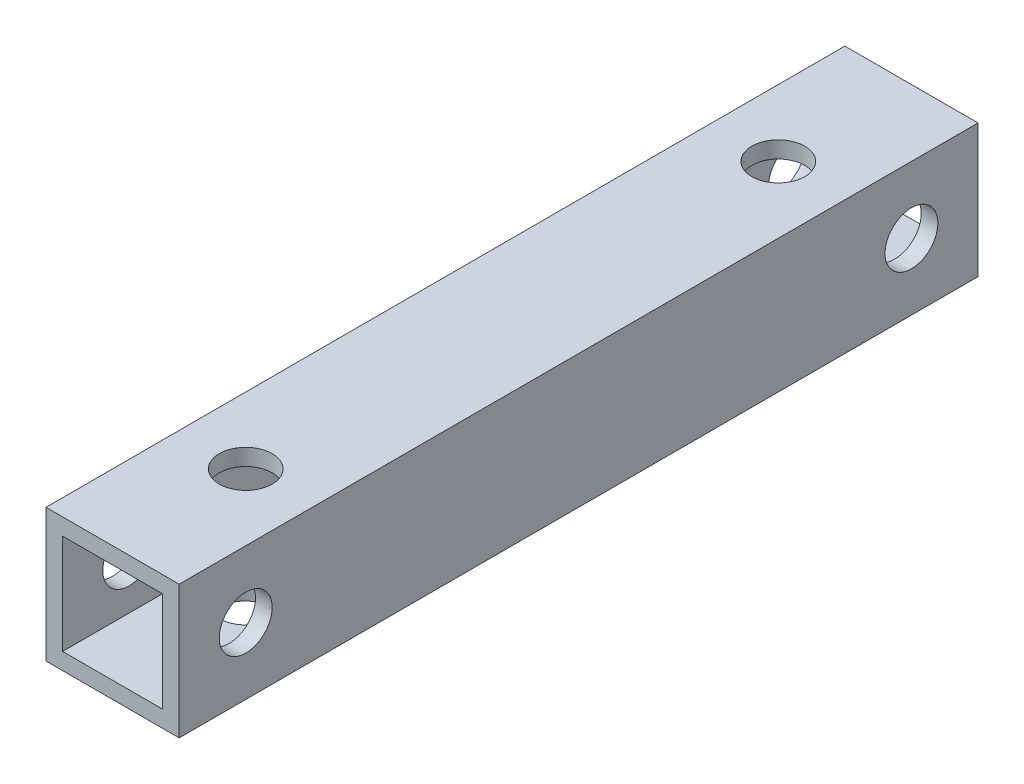
from build123d import *

# Parameters (mm, degrees)
SKETCH1_W               = 25.4
SKETCH1_H               = 25.4
EXTRUDE1_DEPTH          = 76.2
SKETCH2_W               = 19.05
SKETCH2_H               = 19.05
EXTRUDE2_DEPTH          = 154.454683865
F_3_8_CLEARANCE_HOLE1_D = 10.0838
F_3_8_CLEARANCE_HOLE2_D = 10.0838


with BuildPart() as part:
    # Sketch1 → Extrude1 (new, symmetric)
    with BuildSketch(Plane.XY):
        Rectangle(SKETCH1_W, SKETCH1_H)
    extrude(amount=EXTRUDE1_DEPTH, both=True)

    # Sketch2 → Extrude2 (cut, through all)
    with BuildSketch(Plane.XY.offset(76.2)):
        Rectangle(SKETCH2_W, SKETCH2_H)
    extrude(amount=-EXTRUDE2_DEPTH, mode=Mode.SUBTRACT)

    # 3/8 Clearance Hole1 (through all)
    with Locations(Plane(origin=(12.7, 0, 0), x_dir=(0, 0, -1), z_dir=(1, 0, 0))):
        with Locations((-63.5, 0)):
            f_3_8_clearance_hole1 = Hole(F_3_8_CLEARANCE_HOLE1_D / 2)

    # 3/8 Clearance Hole2 (through all)
    with Locations(Plane(origin=(0, 12.7, 0), x_dir=(-1, 0, 0), z_dir=(0, 1, 0))):
        with Locations((0, 50.8)):
            f_3_8_clearance_hole2 = Hole(F_3_8_CLEARANCE_HOLE2_D / 2)

    # Mirror1: 3/8 Clearance Hole1, 3/8 Clearance Hole2 across plane
    add(f_3_8_clearance_hole1.mirror(Plane.XY), mode=Mode.SUBTRACT)
    add(f_3_8_clearance_hole2.mirror(Plane.XY), mode=Mode.SUBTRACT)


solid = part.part
